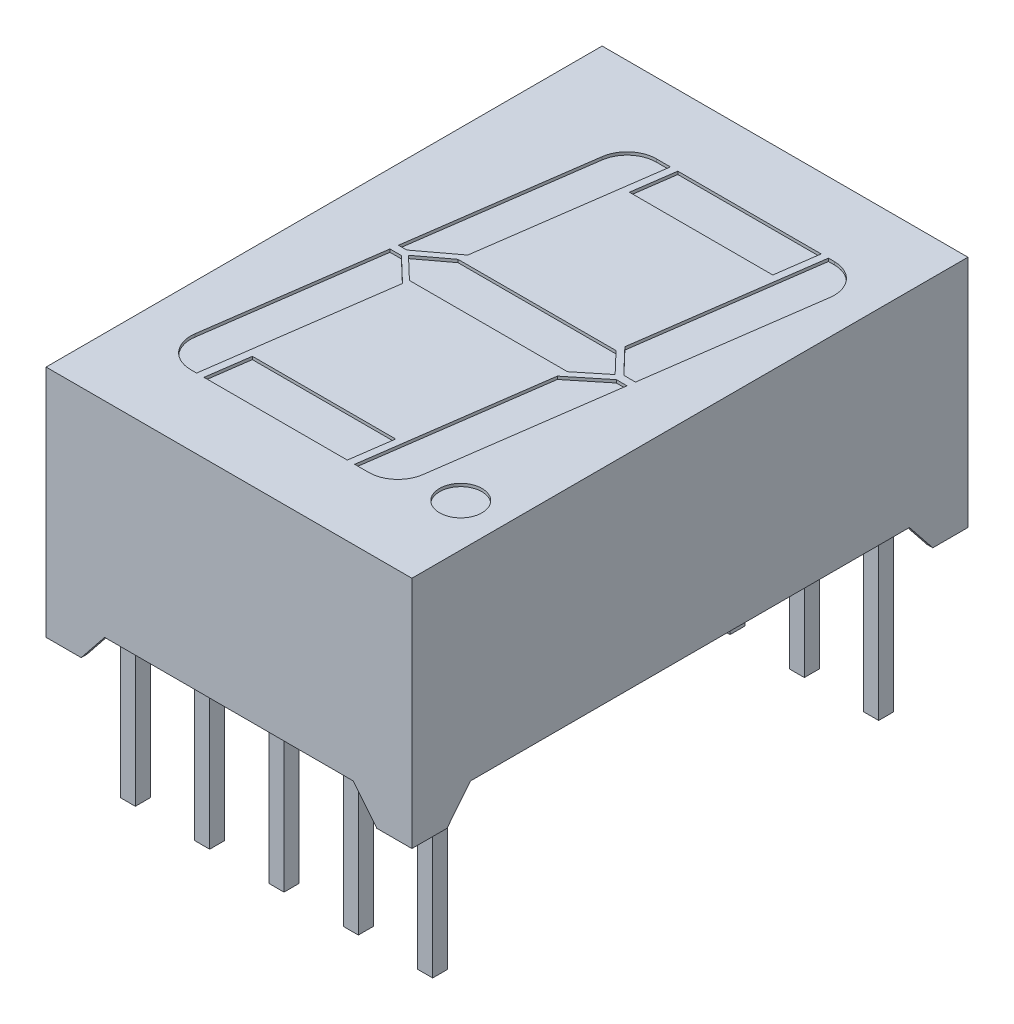
from build123d import *

# Parameters (mm, degrees)
CROQUIS1_W              = 12.5
CROQUIS1_H              = 19
SALIENTE_EXTRUIR1_DEPTH = 8
CROQUIS4_W              = 12.1
CROQUIS4_H              = 18.6
CORTAR_EXTRUIR3_DEPTH   = 1
CORTAR_EXTRUIR1_DEPTH   = 18.621010187
CORTAR_EXTRUIR2_DEPTH   = 22.542109925
CROQUIS5_W              = 12.1
CROQUIS5_H              = 18.6
CORTAR_EXTRUIR4_DEPTH   = 0.2
CROQUIS6_W              = 0.51
CROQUIS6_H              = 0.51
SALIENTE_EXTRUIR2_DEPTH = 6.3
CROQUIS7_R              = 0.725
CORTAR_EXTRUIR5_DEPTH   = 0.1


with BuildPart() as part:
    # Croquis1 → Saliente-Extruir1 (new body)
    with BuildSketch(Plane(origin=(0, 0, 0), x_dir=(1, 0, 0), z_dir=(0, 1, 0))):
        Rectangle(CROQUIS1_W, CROQUIS1_H)
    extrude(amount=SALIENTE_EXTRUIR1_DEPTH)

    # Croquis4 → Cortar-Extruir3 (cut)
    with BuildSketch(Plane(origin=(0, 0, 0), x_dir=(1, 0, 0), z_dir=(0, 1, 0))):
        Rectangle(CROQUIS4_W, CROQUIS4_H)
    extrude(amount=CORTAR_EXTRUIR3_DEPTH, mode=Mode.SUBTRACT)

    # Croquis2 → Cortar-Extruir1 (cut, through all)
    with BuildSketch(Plane(origin=(6.25, 0, 0), x_dir=(0, 0, -1), z_dir=(1, 0, 0))):
        Polygon((-8.3, 0), (0, 0), (0, 1), (-7.5, 1), align=None)
        Polygon((0, 1), (0, 0), (8.3, 0), (7.5, 1), align=None)
    extrude(amount=-CORTAR_EXTRUIR1_DEPTH, mode=Mode.SUBTRACT)

    # Croquis3 → Cortar-Extruir2 (cut, through all)
    with BuildSketch(Plane.XY.offset(9.5)):
        Polygon((0, 1), (0, 0), (5.05, 0), (4.25, 1), align=None)
        Polygon((-5.05, 0), (0, 0), (0, 1), (-4.25, 1), align=None)
    extrude(amount=-CORTAR_EXTRUIR2_DEPTH, mode=Mode.SUBTRACT)

    # Croquis5 → Cortar-Extruir4 (cut)
    with BuildSketch(Plane.XZ.offset(-1)):
        Rectangle(CROQUIS5_W, CROQUIS5_H)
    extrude(amount=-CORTAR_EXTRUIR4_DEPTH, mode=Mode.SUBTRACT)

    # Croquis6 → Saliente-Extruir2 (add)
    with BuildSketch(Plane.XZ.offset(-1.2)):
        with Locations((5.08, 7.62)):
            Rectangle(CROQUIS6_W, CROQUIS6_H)
        with Locations((-5.08, 7.62)):
            Rectangle(CROQUIS6_W, CROQUIS6_H)
        with Locations((-2.54, 7.62)):
            Rectangle(CROQUIS6_W, CROQUIS6_H)
        with Locations((0, 7.62)):
            Rectangle(CROQUIS6_W, CROQUIS6_H)
        with Locations((2.54, 7.62)):
            Rectangle(CROQUIS6_W, CROQUIS6_H)
        with Locations((5.08, -7.62)):
            Rectangle(CROQUIS6_W, CROQUIS6_H)
        with Locations((2.54, -7.62)):
            Rectangle(CROQUIS6_W, CROQUIS6_H)
        with Locations((0, -7.62)):
            Rectangle(CROQUIS6_W, CROQUIS6_H)
        with Locations((-2.54, -7.62)):
            Rectangle(CROQUIS6_W, CROQUIS6_H)
        with Locations((-5.08, -7.62)):
            Rectangle(CROQUIS6_W, CROQUIS6_H)
    extrude(amount=SALIENTE_EXTRUIR2_DEPTH)

    # Croquis7 → Cortar-Extruir5 (cut)
    with BuildSketch(Plane(origin=(0, 8, 0), x_dir=(1, 0, 0), z_dir=(0, 1, 0))):
        with BuildLine():
            Line((5.08455374, 5.950418058), (4.266083352, 0.125))
            Line((4.266083352, 0.125), (3.866083352, 0.125))
            Line((3.866083352, 0.125), (3.037577222, 0.989725951))
            Line((3.037577222, 0.989725951), (3.894601803, 7.089551363))
            Line((3.894601803, 7.089551363), (4.094280079, 7.089551363))
            ThreePointArc((4.094280079, 7.089551363), (4.848976476, 6.745625556), (5.08455374, 5.950418058))
        make_face()
        with BuildLine():
            Line((1.9, -7.106917481), (2.380677984, -7.106917481))
            ThreePointArc((2.380677984, -7.106917481), (3.036752178, -6.861613878), (3.370951645, -6.246050786))
            Line((3.370951645, -6.246050786), (4.230255889, -0.13))
            Line((4.230255889, -0.13), (3.866081115, -0.13))
            Line((3.866081115, -0.13), (2.753310906, -1.033523948))
            Line((2.753310906, -1.033523948), (1.9, -7.106917481))
        make_face()
        Polygon((0, 0.725), (-2.399616736, 0.725), (-2.604044024, -0.73), (0, -0.73), (2.795955976, -0.73), (3.000383264, 0.725), align=None)
        Polygon((1.853724789, -5.656917481), (-3.043819744, -5.656917481), (-3.247544533, -7.106917481), (1.65, -7.106917481), align=None)
        with BuildLine():
            ThreePointArc((-3.699678276, -7.106917481), (-4.454374673, -6.762991674), (-4.689951937, -5.967784176))
            Line((-4.689951937, -5.967784176), (-3.869744111, -0.13))
            Line((-3.869744111, -0.13), (-3.476909246, -0.13))
            Line((-3.476909246, -0.13), (-2.633262018, -0.937957469))
            Line((-2.633262018, -0.937957469), (-3.5, -7.106917481))
            Line((-3.5, -7.106917481), (-3.699678276, -7.106917481))
        make_face()
        with BuildLine():
            ThreePointArc((-2.976349842, 6.228684668), (-2.642150375, 6.84424776), (-1.986076181, 7.089551363))
            Line((-1.986076181, 7.089551363), (-1.505398197, 7.089551363))
            Line((-1.505398197, 7.089551363), (-2.358391548, 1.018418011))
            Line((-2.358391548, 1.018418011), (-3.549623917, 0.125))
            Line((-3.549623917, 0.125), (-3.833916648, 0.125))
            Line((-3.833916648, 0.125), (-2.976349842, 6.228684668))
        make_face()
        Polygon((-2.399616736, 0.725), (-2.604044024, -0.73), (-3.366290182, 0), align=None)
        Polygon((3.000383264, 0.725), (3.69501599, 0), (2.795955976, -0.73), align=None)
        with Locations(Location((4.787756453, -6.368008077, 0), (0, 0, 270))):
            Circle(CROQUIS7_R)
        Polygon((-1.25294273, 7.089551363), (-1.456667518, 5.639551363), (0, 5.639551363), (3.441812575, 5.639551363), (3.645537364, 7.089551363), (0, 7.089551363), align=None)
    extrude(amount=-CORTAR_EXTRUIR5_DEPTH, mode=Mode.SUBTRACT)


solid = part.part
